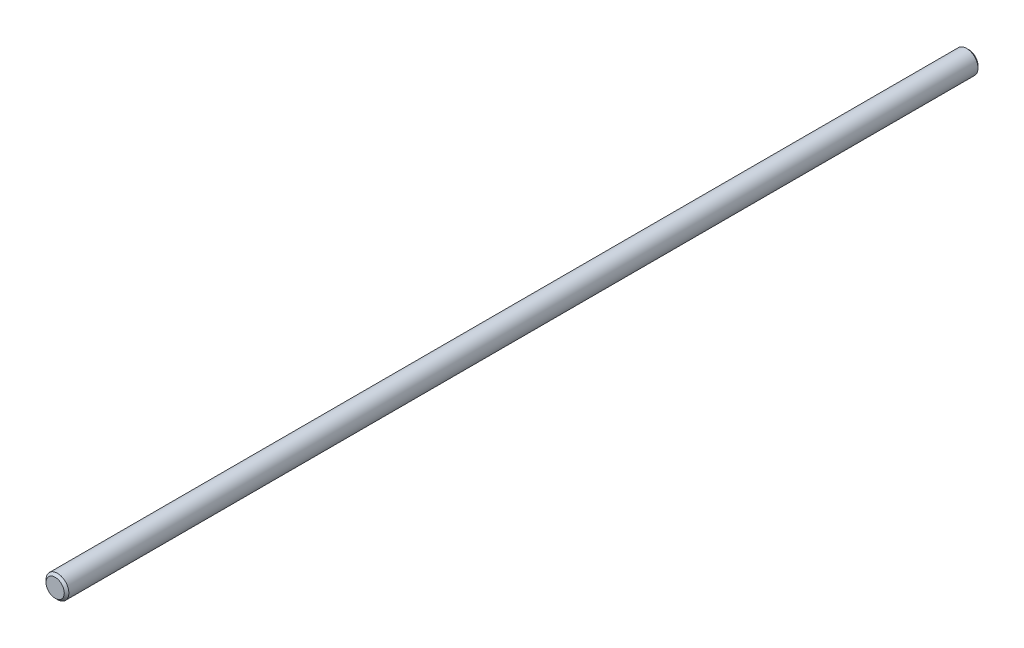
from build123d import *

# Parameters (mm, degrees)
SKETCH3_R           = 4.7625
BOSS_EXTRUDE1_DEPTH = 190.5
CHAMFER1_SIZE       = 0.9525


with BuildPart() as part:
    # Sketch3 → Boss-Extrude1 (new, symmetric)
    with BuildSketch(Plane.XY):
        Circle(SKETCH3_R)
    extrude(amount=BOSS_EXTRUDE1_DEPTH, both=True)

    # Chamfer1
    chamfer1_edges = [part.edges().sort_by_distance(p)[0] for p in [
        (-4.7625, 0, -190.5),
        (-4.7625, 0, 190.5),
    ]]
    chamfer(chamfer1_edges, length=CHAMFER1_SIZE)


solid = part.part
